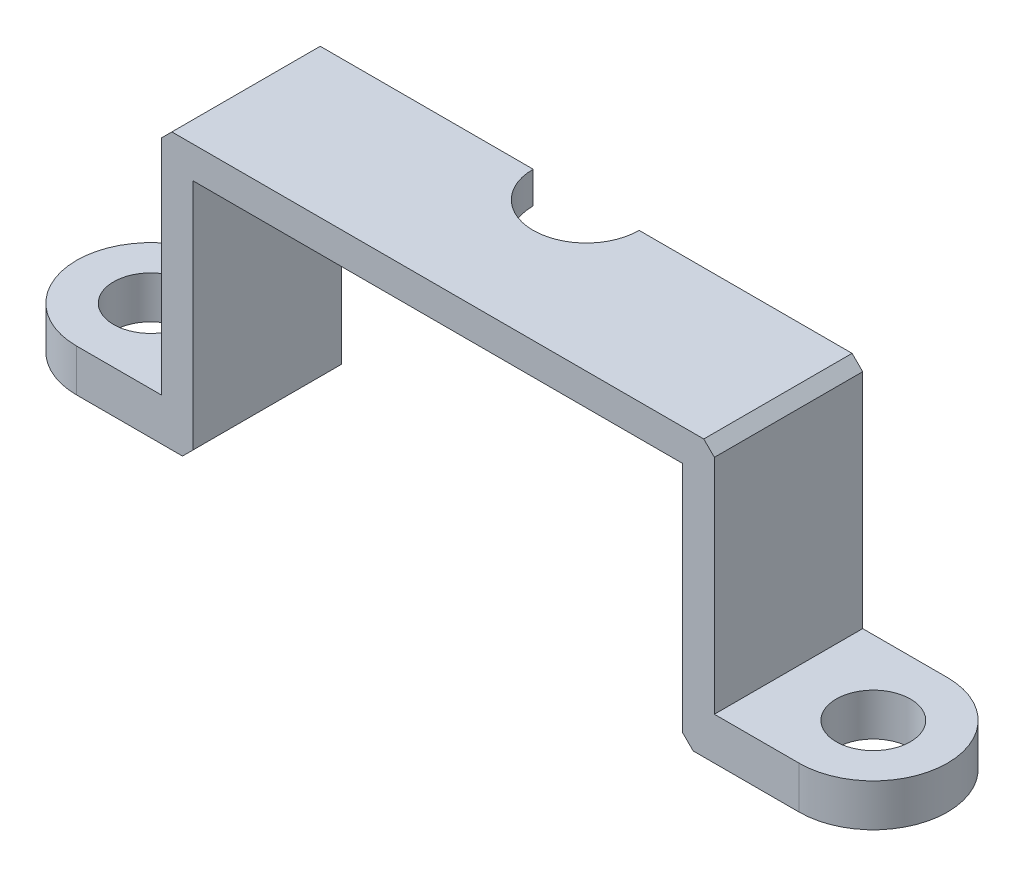
from build123d import *

# Parameters (mm, degrees)
BOSS_EXTRUDE1_DEPTH      = 7
SKETCH2_R                = 1.75
CUT_EXTRUDE1_DEPTH       = 25.760906688
CHAMFER1_SIZE            = 0.5
CHAMFER1_OF_MIRROR1_SIZE = 0.5
CUT_EXTRUDE2_DEPTH       = 26.304199256


with BuildPart() as part:
    # Sketch1 → Boss-Extrude1 (new body)
    with BuildSketch(Plane.XY):
        Polygon((0, 11.5), (11.55, 11.5), (11.55, 0), (21.05, 0), (21.05, 2), (13.05, 2), (13.05, 13), (0, 13), align=None)
    boss_extrude1 = extrude(amount=BOSS_EXTRUDE1_DEPTH)

    # Sketch2 → Cut-Extrude1 (cut, through all)
    with BuildSketch(Plane(origin=(0, 2, 0), x_dir=(1, 0, 0), z_dir=(0, 1, 0))):
        with Locations(Location((17.05, -3.5, 0), (0, 0, 180))):
            Circle(SKETCH2_R)
        with BuildLine():
            Line((17.05, 0), (21.05, 0))
            Line((21.05, 0), (21.05, -7))
            Line((21.05, -7), (17.05, -7))
            ThreePointArc((17.05, -7), (20.55, -3.5), (17.05, 0))
        make_face()
    cut_extrude1 = extrude(amount=-CUT_EXTRUDE1_DEPTH, mode=Mode.SUBTRACT)

    # Chamfer1
    chamfer1_edges = [part.edges().sort_by_distance(p)[0] for p in [
        (11.55, 0, 3.5),
        (13.05, 13, 3.5),
    ]]
    chamfer(chamfer1_edges, length=CHAMFER1_SIZE)

    # Mirror1: Boss-Extrude1, Cut-Extrude1 across plane
    add(boss_extrude1.mirror(Plane(origin=(0, 0, 0), x_dir=(0, 0, 1), z_dir=(1, 0, 0))))
    add(cut_extrude1.mirror(Plane(origin=(0, 0, 0), x_dir=(0, 0, 1), z_dir=(1, 0, 0))), mode=Mode.SUBTRACT)

    # Chamfer1 of Mirror1
    chamfer1_of_mirror1_edges = [part.edges().sort_by_distance(p)[0] for p in [
        (-11.55, 0, 3.5),
        (-13.05, 13, 3.5),
    ]]
    chamfer(chamfer1_of_mirror1_edges, length=CHAMFER1_OF_MIRROR1_SIZE)

    # Sketch3 → Cut-Extrude2 (cut, through all)
    with BuildSketch(Plane(origin=(0, 13, 0), x_dir=(1, 0, 0), z_dir=(0, 1, 0))):
        with BuildLine():
            Line((-2.5, 0), (2.5, 0))
            ThreePointArc((2.5, 0), (0, -2.5), (-2.5, 0))
        make_face()
    extrude(amount=-CUT_EXTRUDE2_DEPTH, mode=Mode.SUBTRACT)


solid = part.part
